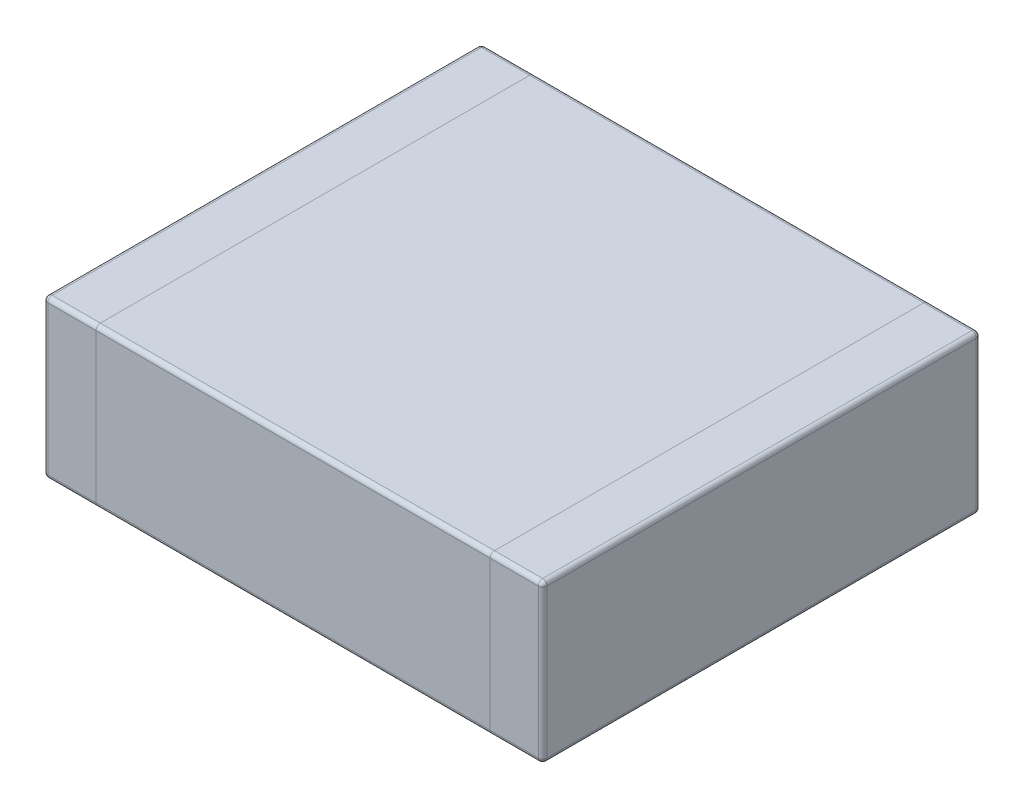
from build123d import *

# Parameters (mm, degrees)
SKETCH1_W      = 5.7
SKETCH1_H      = 5
EXTRUDE1_DEPTH = 1.8
FILLET1_R      = 0.05


with BuildPart() as part:
    # Sketch1 → Extrude1 (new body)
    with BuildSketch(Plane(origin=(0, 0, 0), x_dir=(1, 0, 0), z_dir=(0, 1, 0))):
        Rectangle(SKETCH1_W, SKETCH1_H)
    extrude(amount=EXTRUDE1_DEPTH)

    # Fillet1
    fillet1_edges = [part.edges().sort_by_distance(p)[0] for p in [
        (-2.85, 1.8, 0),
        (0, 1.8, 2.5),
        (2.85, 1.8, 0),
        (0, 0, 2.5),
        (-2.85, 0, 0),
        (0, 0, -2.5),
        (2.85, 0, 0),
        (0, 1.8, -2.5),
        (2.85, 0.9, 2.5),
        (-2.85, 0.9, 2.5),
        (-2.85, 0.9, -2.5),
        (2.85, 0.9, -2.5),
    ]]
    fillet(fillet1_edges, radius=FILLET1_R)


solid = part.part
